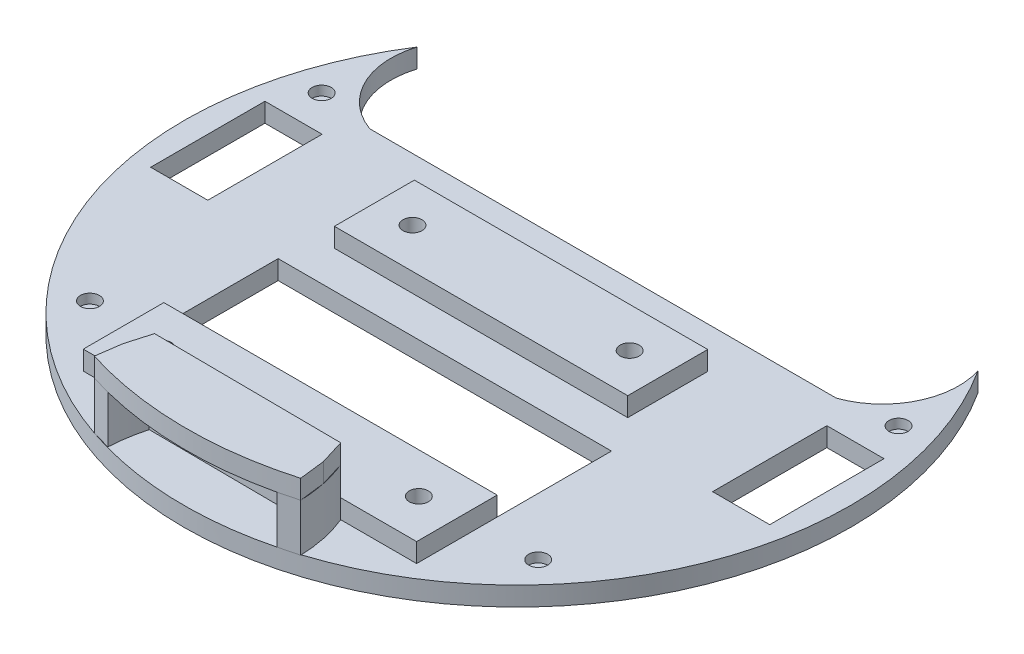
from build123d import *

# Parameters (mm, degrees)
BASEDIA_R           = 175
BOSS_EXTRUDE1_DEPTH = 10
SKETCH2_W           = 175
SKETCH2_H           = 60
CUT_EXTRUDE3_DEPTH  = 10
CUT_EXTRUDE5_START  = -10
SKETCH5_W           = 30
SKETCH5_H           = 60
CUT_EXTRUDE5_DEPTH  = 10
BOSS_EXTRUDE2_DEPTH = 25
SKETCH8_W           = 175
SKETCH8_H           = 42.297309852
SKETCH8_R           = 5
BOSS_EXTRUDE3_DEPTH = 10
SKETCH9_W           = 154
SKETCH9_H           = 42
SKETCH9_R           = 5
BOSS_EXTRUDE4_DEPTH = 10
SKETCH10_R          = 5
CUT_EXTRUDE6_DEPTH  = 5
SKETCH11_W          = 60
SKETCH11_H          = 3
CUT_EXTRUDE7_DEPTH  = 10
BOSS_EXTRUDE5_DEPTH = 10


with BuildPart() as part:
    # basedia → Boss-Extrude1 (new body)
    with BuildSketch(Plane(origin=(0, 0, 0), x_dir=(1, 0, 0), z_dir=(0, 1, 0))):
        with Locations(Location((0, 0, 0), (0, 0, 270))):
            Circle(BASEDIA_R)
    extrude(amount=BOSS_EXTRUDE1_DEPTH)

    # Sketch2 → Cut-Extrude3 (cut)
    with BuildSketch(Plane(origin=(0, 0, 0), x_dir=(1, 0, 0), z_dir=(0, 1, 0))):
        with Locations((0, -68.076429651)):
            Rectangle(SKETCH2_W, SKETCH2_H)
    extrude(amount=CUT_EXTRUDE3_DEPTH, mode=Mode.SUBTRACT)

    # Sketch5 → Cut-Extrude5 (cut)
    with BuildSketch(Plane(origin=(0, 10, 0), x_dir=(1, 0, 0), z_dir=(0, 1, 0)).offset(CUT_EXTRUDE5_START)):
        with BuildLine():
            Line((-122.466018466, 45), (122.466018466, 45))
            ThreePointArc((122.466018466, 45), (144.830685243, 64.836208714), (147.204111427, 94.63587892))
            ThreePointArc((147.204111427, 94.63587892), (0, 175), (-147.204111427, 94.63587892))
            ThreePointArc((-147.204111427, 94.63587892), (-144.830685243, 64.836208714), (-122.466018466, 45))
        make_face()
        with Locations((-147.5, 0)):
            Rectangle(SKETCH5_W, SKETCH5_H)
        with Locations((147.5, 0)):
            Rectangle(SKETCH5_W, SKETCH5_H)
    extrude(amount=CUT_EXTRUDE5_DEPTH, mode=Mode.SUBTRACT)

    # Sketch7 → Boss-Extrude2 (add)
    with BuildSketch(Plane(origin=(0, 10, 0), x_dir=(1, 0, 0), z_dir=(0, 1, 0))):
        with BuildLine():
            Line((-43.56510526, -149.674915049), (40.559642833, -150.319684554))
            ThreePointArc((40.559642833, -150.319684554), (42.642034938, -159.836675376), (43.310651761, -169.555853464))
            Line((43.310651761, -169.555853464), (53.279307238, -167.030646365))
            ThreePointArc((53.279307238, -167.030646365), (51.661940371, -153.449452713), (47.650653713, -140.373739503))
            Line((47.650653713, -140.373739503), (-50.823489188, -139.61898985))
            ThreePointArc((-50.823489188, -139.61898985), (-54.540052947, -152.439162742), (-56.427487426, -165.65306717))
            Line((-56.427487426, -165.65306717), (-46.575152469, -168.40822556))
            ThreePointArc((-46.575152469, -168.40822556), (-45.593073163, -158.957544204), (-43.56510526, -149.674915049))
        make_face()
    extrude(amount=BOSS_EXTRUDE2_DEPTH)

    # Sketch8 → Boss-Extrude3 (add)
    with BuildSketch(Plane(origin=(0, 10, 0), x_dir=(1, 0, 0), z_dir=(0, 1, 0))):
        with Locations((0, -119.225084577)):
            Rectangle(SKETCH8_W, SKETCH8_H)
        with Locations(Location((-67.5, -119.225084577, 0), (0, 0, 270))):
            Circle(SKETCH8_R, mode=Mode.SUBTRACT)
        with Locations(Location((67.5, -119.225084577, 0), (0, 0, 270))):
            Circle(SKETCH8_R, mode=Mode.SUBTRACT)
    extrude(amount=BOSS_EXTRUDE3_DEPTH)

    # Sketch9 → Boss-Extrude4 (add)
    with BuildSketch(Plane(origin=(0, 10, 0), x_dir=(1, 0, 0), z_dir=(0, 1, 0))):
        with Locations((-0.423800225, 2.37885536)):
            Rectangle(SKETCH9_W, SKETCH9_H)
        with Locations(Location((-57.423800225, 2.37885536, 0), (0, 0, 270))):
            Circle(SKETCH9_R, mode=Mode.SUBTRACT)
        with Locations(Location((56.576199775, 2.37885536, 0), (0, 0, 270))):
            Circle(SKETCH9_R, mode=Mode.SUBTRACT)
    extrude(amount=BOSS_EXTRUDE4_DEPTH)

    # Sketch10 → Cut-Extrude6 (cut)
    with BuildSketch(Plane(origin=(0, 10, 0), x_dir=(1, 0, 0), z_dir=(0, 1, 0))):
        with Locations(Location((-117.665653332, -106.704862813, 0), (0, 0, 270))):
            Circle(SKETCH10_R)
        with Locations(Location((-151.426262726, 48.693236313, 0), (0, 0, 270))):
            Circle(SKETCH10_R)
        with Locations(Location((151.426262726, 48.693236313, 0), (0, 0, 90))):
            Circle(SKETCH10_R)
        with Locations(Location((117.665653332, -106.704862813, 0), (0, 0, 90))):
            Circle(SKETCH10_R)
    extrude(amount=-CUT_EXTRUDE6_DEPTH, mode=Mode.SUBTRACT)

    # Sketch11 → Cut-Extrude7 (cut)
    with BuildSketch(Plane(origin=(0, 0, -45), x_dir=(-1, 0, 0), z_dir=(0, 0, -1))):
        with Locations((-82.041456067, 5.240211955)):
            Rectangle(SKETCH11_W, SKETCH11_H)
        with Locations((82.041456067, 5.240211955)):
            Rectangle(SKETCH11_W, SKETCH11_H)
    extrude(amount=-CUT_EXTRUDE7_DEPTH, mode=Mode.SUBTRACT)

    # Sketch12 → Boss-Extrude5 (add)
    with BuildSketch(Plane(origin=(0, 35, 0), x_dir=(1, 0, 0), z_dir=(0, 1, 0))):
        with BuildLine():
            Line((-50.823489188, -139.61898985), (47.650653713, -140.373739503))
            Line((47.650653713, -140.373739503), (51.661940371, -153.449452713))
            Line((51.661940371, -153.449452713), (53.279307238, -167.030646365))
            ThreePointArc((53.279307238, -167.030646365), (-1.675350263, -174.405951078), (-56.427487426, -165.65306717))
            Line((-56.427487426, -165.65306717), (-54.540052947, -152.439162742))
            Line((-54.540052947, -152.439162742), (-50.823489188, -139.61898985))
        make_face()
    extrude(amount=BOSS_EXTRUDE5_DEPTH)


solid = part.part
